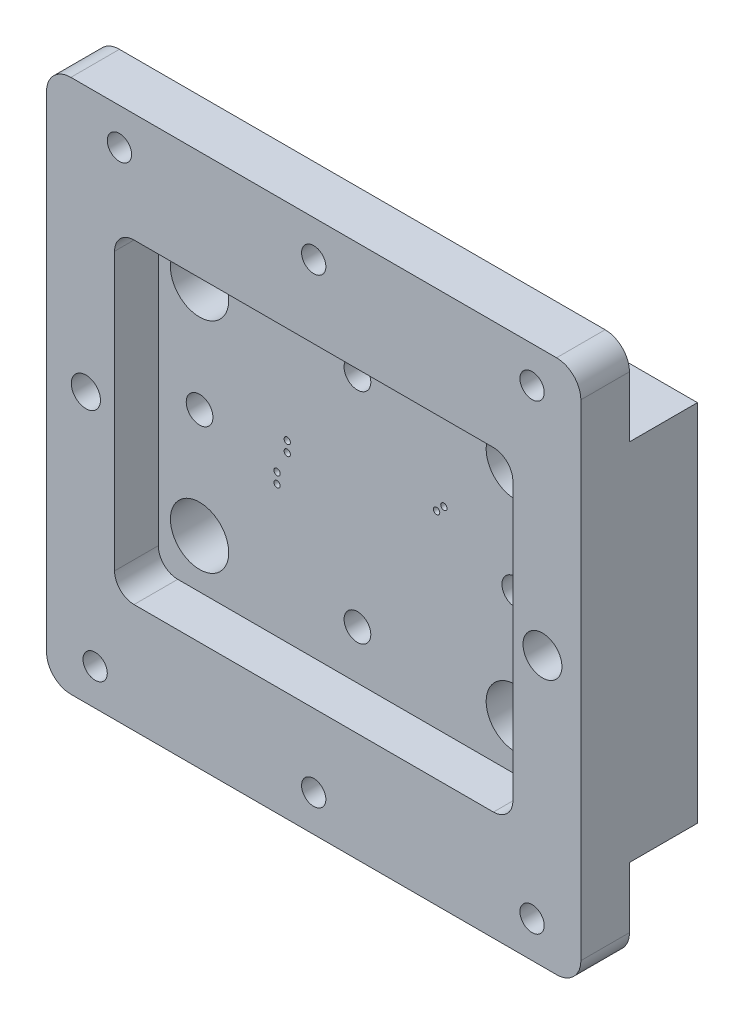
from build123d import *

# Parameters (mm, degrees)
CROQUIS1_W              = 170
CROQUIS1_H              = 147
CROQUIS1_R              = 0.65
SALIENTE_EXTRUIR1_DEPTH = 15
CROQUIS2_R              = 6
CROQUIS2_R_2            = 2.75
CORTAR_EXTRUIR1_DEPTH   = 226.242091981
CROQUIS3_R              = 10
CORTAR_EXTRUIR2_DEPTH   = 4
CROQUIS5_R              = 2.5
CORTAR_EXTRUIR4_DEPTH   = 226.242091981
CROQUIS7_W              = 194.996484343
CROQUIS7_H              = 184.60954518
CORTAR_EXTRUIR6_DEPTH   = 226.242091981
CROQUIS8_R              = 2.5
SALIENTE_EXTRUIR2_DEPTH = 49
CROQUIS11_R             = 3.25
CROQUIS11_R_2           = 2.75
CORTAR_EXTRUIR9_DEPTH   = 20
CROQUIS12_R             = 1.997516107
CROQUIS12_R_2           = 2
CORTAR_EXTRUIR10_DEPTH  = 12
CROQUIS13_W             = 135.039321601
CROQUIS13_H             = 118.061076797
CORTAR_EXTRUIR11_DEPTH  = 40
CROQUIS14_W             = 119.536996173
CROQUIS14_H             = 17.5
CROQUIS14_W_2           = 122.159118923
CORTAR_EXTRUIR12_DEPTH  = 14
CROQUIS10_R             = 4.5
CORTAR_EXTRUIR8_DEPTH   = 6
CROQUIS15_R             = 3.89592378
CROQUIS15_R_2           = 2.9773148
SALIENTE_EXTRUIR3_DEPTH = 24
CORTAR_EXTRUIR13_START  = -9
CORTAR_EXTRUIR13_DEPTH  = 9
CROQUIS17_R             = 3
CROQUIS17_R_2           = 4
CORTAR_EXTRUIR14_DEPTH  = 24


with BuildPart() as part:
    # Croquis1 → Saliente-Extruir1 (new body)
    with BuildSketch(Plane.XY):
        with Locations((85, 73.5)):
            Rectangle(CROQUIS1_W, CROQUIS1_H)
        with Locations((102.354765644, 71.387865203)):
            Circle(CROQUIS1_R, mode=Mode.SUBTRACT)
        with Locations((68.004765644, 60.387865203)):
            Circle(CROQUIS1_R, mode=Mode.SUBTRACT)
        with Locations((68.004765644, 58.237865203)):
            Circle(CROQUIS1_R, mode=Mode.SUBTRACT)
        with Locations((70.104765644, 64.887865203)):
            Circle(CROQUIS1_R, mode=Mode.SUBTRACT)
        with Locations((70.104765644, 67.037865203)):
            Circle(CROQUIS1_R, mode=Mode.SUBTRACT)
        with Locations((100.854765644, 69.887865203)):
            Circle(CROQUIS1_R, mode=Mode.SUBTRACT)
    extrude(amount=SALIENTE_EXTRUIR1_DEPTH)

    # Croquis2 → Cortar-Extruir1 (cut, through all)
    with BuildSketch(Plane(origin=(0, 0, 0), x_dir=(-1, 0, 0), z_dir=(0, 0, -1))):
        with Locations((-52.054764009, 86.037865203)):
            Circle(CROQUIS2_R)
        with Locations((-117.054764009, 86.037865203)):
            Circle(CROQUIS2_R)
        with Locations((-117.054764009, 41.037865203)):
            Circle(CROQUIS2_R)
        with Locations((-52.054764009, 41.037865203)):
            Circle(CROQUIS2_R)
        with Locations((-117.054764009, 63.537865203)):
            Circle(CROQUIS2_R_2)
        with Locations((-52.054764009, 63.537865203)):
            Circle(CROQUIS2_R_2)
        with Locations((-84.554764009, 86.037865203)):
            Circle(CROQUIS2_R_2)
        with Locations((-84.554764009, 41.037865203)):
            Circle(CROQUIS2_R_2)
    extrude(amount=-CORTAR_EXTRUIR1_DEPTH, mode=Mode.SUBTRACT)

    # Croquis3 → Cortar-Extruir2 (cut)
    with BuildSketch(Plane(origin=(0, 0, 0), x_dir=(-1, 0, 0), z_dir=(0, 0, -1))):
        with Locations((-52.054764009, 86.037865203)):
            Circle(CROQUIS3_R)
        with Locations((-117.054764009, 86.037865203)):
            Circle(CROQUIS3_R)
        with Locations((-117.054764009, 41.037865203)):
            Circle(CROQUIS3_R)
        with Locations((-52.054764009, 41.037865203)):
            Circle(CROQUIS3_R)
    extrude(amount=-CORTAR_EXTRUIR2_DEPTH, mode=Mode.SUBTRACT)

    # Croquis5 → Cortar-Extruir4 (cut, through all)
    with BuildSketch(Plane(origin=(0, 0, 0), x_dir=(-1, 0, 0), z_dir=(0, 0, -1))):
        with Locations((-84.554764009, 111.037865203)):
            Circle(CROQUIS5_R)
        with Locations((-44.554764009, 111.037865203)):
            Circle(CROQUIS5_R)
        with Locations((-129.51388638, 111.061182682)):
            Circle(CROQUIS5_R)
        with Locations(Location((-129.51388638, 16.014547725, 0), (0, 0, 180))):
            Circle(CROQUIS5_R)
        with Locations(Location((-39.554764009, 16.037865203, 0), (0, 0, 180))):
            Circle(CROQUIS5_R)
        with Locations(Location((-84.554764009, 16.037865203, 0), (0, 0, 180))):
            Circle(CROQUIS5_R)
    extrude(amount=-CORTAR_EXTRUIR4_DEPTH, mode=Mode.SUBTRACT)

    # Croquis7 → Cortar-Extruir6 (cut, through all)
    with BuildSketch(Plane(origin=(0, 0, 0), x_dir=(-1, 0, 0), z_dir=(0, 0, -1))):
        with Locations((-84.554764009, 63.537865203)):
            Rectangle(CROQUIS7_W, CROQUIS7_H)
        with BuildLine():
            Line((-134.554764009, 8.537865203), (-34.554764009, 8.537865203))
            ThreePointArc((-34.554764009, 8.537865203), (-31.019230103, 10.002331297), (-29.554764009, 13.537865203))
            Line((-29.554764009, 13.537865203), (-29.554764009, 113.537865203))
            ThreePointArc((-29.554764009, 113.537865203), (-31.019230103, 117.073399109), (-34.554764009, 118.537865203))
            Line((-34.554764009, 118.537865203), (-134.554764009, 118.537865203))
            ThreePointArc((-134.554764009, 118.537865203), (-138.090297915, 117.073399109), (-139.554764009, 113.537865203))
            Line((-139.554764009, 113.537865203), (-139.554764009, 13.537865203))
            ThreePointArc((-139.554764009, 13.537865203), (-138.090297915, 10.002331297), (-134.554764009, 8.537865203))
        make_face(mode=Mode.SUBTRACT)
    extrude(amount=-CORTAR_EXTRUIR6_DEPTH, mode=Mode.SUBTRACT)

    # Croquis8 → Saliente-Extruir2 (add)
    with BuildSketch(Plane.XY.offset(15)):
        with BuildLine():
            Line((29.554764009, 113.537865203), (29.554764009, 13.537865203))
            ThreePointArc((29.554764009, 13.537865203), (31.019230103, 10.002331297), (34.554764009, 8.537865203))
            Line((34.554764009, 8.537865203), (134.554764009, 8.537865203))
            ThreePointArc((134.554764009, 8.537865203), (138.090297915, 10.002331297), (139.554764009, 13.537865203))
            Line((139.554764009, 13.537865203), (139.554764009, 113.537865203))
            ThreePointArc((139.554764009, 113.537865203), (138.090297915, 117.073399109), (134.554764009, 118.537865203))
            Line((134.554764009, 118.537865203), (34.554764009, 118.537865203))
            ThreePointArc((34.554764009, 118.537865203), (31.019230103, 117.073399109), (29.554764009, 113.537865203))
        make_face()
        with Locations(Location((44.554764009, 111.037865203, 0), (0, 0, 180))):
            Circle(CROQUIS8_R, mode=Mode.SUBTRACT)
        with Locations(Location((84.554764009, 111.037865203, 0), (0, 0, 180))):
            Circle(CROQUIS8_R, mode=Mode.SUBTRACT)
        with Locations(Location((129.51388638, 111.061182682, 0), (0, 0, 180))):
            Circle(CROQUIS8_R, mode=Mode.SUBTRACT)
        with Locations((129.51388638, 16.014547725)):
            Circle(CROQUIS8_R, mode=Mode.SUBTRACT)
        with Locations((84.554764009, 16.037865203)):
            Circle(CROQUIS8_R, mode=Mode.SUBTRACT)
        with Locations((39.554764009, 16.037865203)):
            Circle(CROQUIS8_R, mode=Mode.SUBTRACT)
        with BuildLine():
            Line((47.558208504, 31.037865203), (121.558208504, 31.037865203))
            ThreePointArc((121.558208504, 31.037865203), (124.386635629, 32.209438078), (125.558208504, 35.037865203))
            Line((125.558208504, 35.037865203), (125.558208504, 92.037865203))
            ThreePointArc((125.558208504, 92.037865203), (124.386635629, 94.866292328), (121.558208504, 96.037865203))
            Line((121.558208504, 96.037865203), (47.558208504, 96.037865203))
            ThreePointArc((47.558208504, 96.037865203), (44.72978138, 94.866292328), (43.558208504, 92.037865203))
            Line((43.558208504, 92.037865203), (43.558208504, 35.037865203))
            ThreePointArc((43.558208504, 35.037865203), (44.72978138, 32.209438078), (47.558208504, 31.037865203))
        make_face(mode=Mode.SUBTRACT)
    extrude(amount=SALIENTE_EXTRUIR2_DEPTH)

    # Croquis11 → Cortar-Extruir9 (cut)
    with BuildSketch(Plane(origin=(0, 0, 0), x_dir=(-1, 0, 0), z_dir=(0, 0, -1))):
        with Locations((-41.554764009, 63.537865203)):
            Circle(CROQUIS11_R)
        with Locations((-135.554764009, 63.537865203)):
            Circle(CROQUIS11_R_2)
    extrude(amount=-CORTAR_EXTRUIR9_DEPTH, mode=Mode.SUBTRACT)

    # Croquis12 → Cortar-Extruir10 (cut)
    with BuildSketch(Plane(origin=(0, 0, 0), x_dir=(-1, 0, 0), z_dir=(0, 0, -1))):
        with Locations((-36.554764009, 94.037865203)):
            Circle(CROQUIS12_R)
        with Locations((-36.554764009, 33.037865203)):
            Circle(CROQUIS12_R_2)
        with Locations((-132.554764009, 33.037865203)):
            Circle(CROQUIS12_R_2)
        with Locations((-132.554764009, 94.037865203)):
            Circle(CROQUIS12_R_2)
    extrude(amount=-CORTAR_EXTRUIR10_DEPTH, mode=Mode.SUBTRACT)

    # Croquis13 → Cortar-Extruir11 (cut)
    with BuildSketch(Plane.XY.offset(64)):
        with Locations((90.028445249, 63.21009986)):
            Rectangle(CROQUIS13_W, CROQUIS13_H)
    extrude(amount=-CORTAR_EXTRUIR11_DEPTH, mode=Mode.SUBTRACT)

    # Croquis14 → Cortar-Extruir12 (cut)
    with BuildSketch(Plane(origin=(0, 0, 0), x_dir=(-1, 0, 0), z_dir=(0, 0, -1))):
        with Locations((-79.786265922, 109.787865203)):
            Rectangle(CROQUIS14_W, CROQUIS14_H)
        with Locations((-78.475204547, 17.287865203)):
            Rectangle(CROQUIS14_W_2, CROQUIS14_H)
    extrude(amount=-CORTAR_EXTRUIR12_DEPTH, mode=Mode.SUBTRACT)

    # Croquis10 → Cortar-Extruir8 (cut)
    with BuildSketch(Plane(origin=(0, 0, 14), x_dir=(-1, 0, 0), z_dir=(0, 0, -1))):
        with Locations((-44.554764009, 111.037865203)):
            Circle(CROQUIS10_R)
        with Locations((-84.554764009, 111.037865203)):
            Circle(CROQUIS10_R)
        with Locations((-129.51388638, 111.061182682)):
            Circle(CROQUIS10_R)
        with Locations((-129.554764009, 16.037865203)):
            Circle(CROQUIS10_R)
        with Locations((-84.554764009, 16.037865203)):
            Circle(CROQUIS10_R)
        with Locations((-39.554764009, 16.037865203)):
            Circle(CROQUIS10_R)
    extrude(amount=-CORTAR_EXTRUIR8_DEPTH, mode=Mode.SUBTRACT)

    # Croquis15 → Saliente-Extruir3 (add)
    with BuildSketch(Plane(origin=(0, 0, 0), x_dir=(-1, 0, 0), z_dir=(0, 0, -1))):
        with Locations((-41.554764009, 63.537865203)):
            Circle(CROQUIS15_R)
        with Locations((-135.554764009, 63.537865203)):
            Circle(CROQUIS15_R_2)
    extrude(amount=-SALIENTE_EXTRUIR3_DEPTH)

    # Croquis16 → Cortar-Extruir13 (cut)
    with BuildSketch(Plane.XY.offset(24).offset(CORTAR_EXTRUIR13_START)):
        with BuildLine():
            Line((43.558208504, 66.879187135), (43.558208504, 60.196543272))
            ThreePointArc((43.558208504, 60.196543272), (45.450687788, 63.537865203), (43.558208504, 66.879187135))
        make_face()
    extrude(amount=CORTAR_EXTRUIR13_DEPTH, mode=Mode.SUBTRACT)

    # Croquis17 → Cortar-Extruir14 (cut)
    with BuildSketch(Plane(origin=(0, 0, 0), x_dir=(-1, 0, 0), z_dir=(0, 0, -1))):
        with Locations((-37.65059727, 64.010566888)):
            Circle(CROQUIS17_R)
        with Locations((-131.65059727, 64.010566888)):
            Circle(CROQUIS17_R_2)
    extrude(amount=-CORTAR_EXTRUIR14_DEPTH, mode=Mode.SUBTRACT)


solid = part.part
